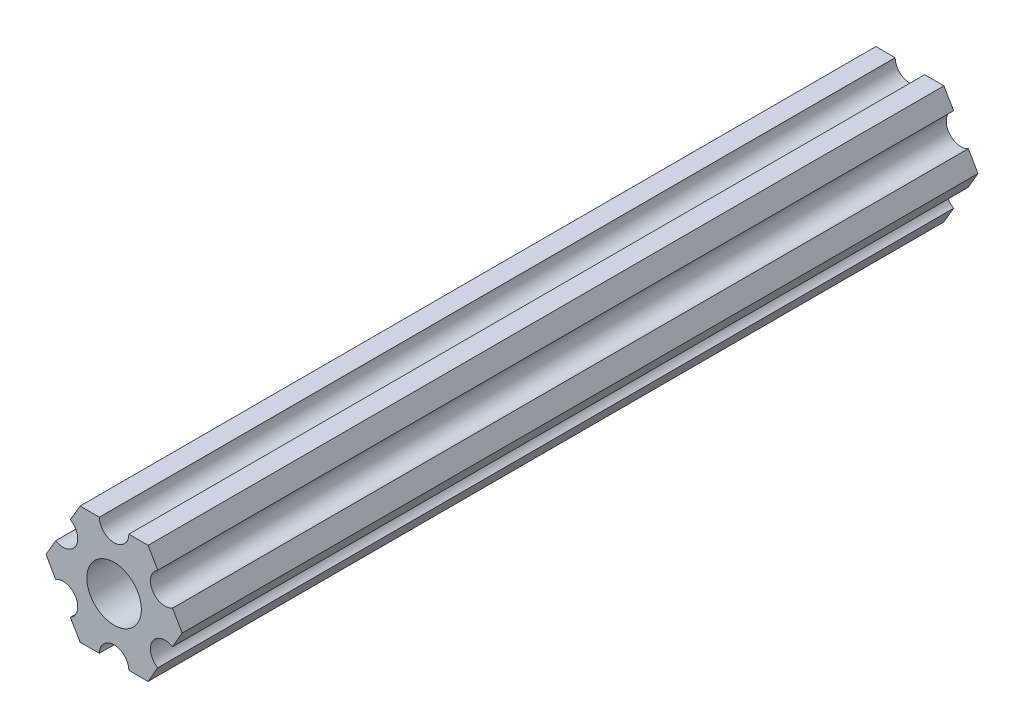
from build123d import *

# Parameters (mm, degrees)
SKETCH1_R           = 2.9337
BOSS_EXTRUDE1_DEPTH = 85.725


with BuildPart() as part:
    # Sketch1 → Boss-Extrude1 (new body)
    with BuildSketch(Plane.XY.offset(304.8)):
        with BuildLine():
            Line((6.293011699, -1.800184894), (7.332348803, -2.22e-07))
            Line((7.332348803, -2.22e-07), (6.293011439, 1.800184522))
            ThreePointArc((6.293011439, 1.800184522), (4.124446058, 2.381249653), (4.705511189, 4.549815034))
            Line((4.705511189, 4.549815034), (3.666173825, 6.349999778))
            Line((3.666173825, 6.349999778), (1.587499615, 6.349999778))
            ThreePointArc((1.587499615, 6.349999778), (-3.85e-07, 4.762499778), (-1.587500385, 6.349999778))
            Line((-1.587500385, 6.349999778), (-3.666174594, 6.349999778))
            Line((-3.666174594, 6.349999778), (-4.70551159, 4.549815043))
            ThreePointArc((-4.70551159, 4.549815043), (-4.12444613, 2.38124975), (-6.293011423, 1.80018429))
            Line((-6.293011423, 1.80018429), (-7.332348419, -4.44e-07))
            Line((-7.332348419, -4.44e-07), (-6.293011205, -1.800185053))
            ThreePointArc((-6.293011205, -1.800185053), (-4.124445841, -2.38125025), (-4.705511038, -4.549815614))
            Line((-4.705511038, -4.549815614), (-3.666173825, -6.350000222))
            Line((-3.666173825, -6.350000222), (-1.587499615, -6.350000222))
            ThreePointArc((-1.587499615, -6.350000222), (3.85e-07, -4.762500222), (1.587500385, -6.350000222))
            Line((1.587500385, -6.350000222), (3.666174594, -6.350000222))
            Line((3.666174594, -6.350000222), (4.705511699, -4.549815551))
            ThreePointArc((4.705511699, -4.549815551), (4.12444637, -2.381250222), (6.293011699, -1.800184894))
        make_face()
        with Locations(Location((0, 0, 0), (0, 0, 180))):
            Circle(SKETCH1_R, mode=Mode.SUBTRACT)
    extrude(amount=-BOSS_EXTRUDE1_DEPTH)


solid = part.part
